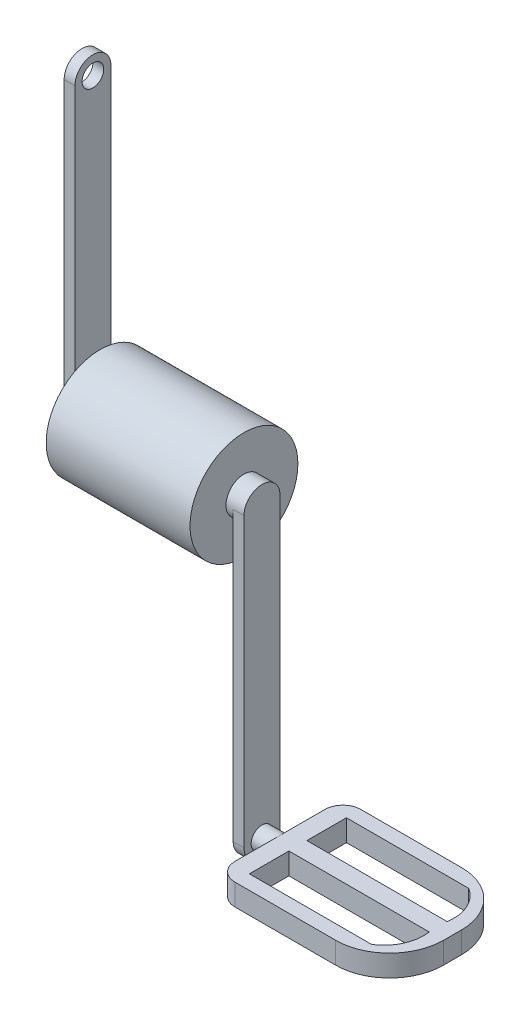
from build123d import *

# Parameters (mm, degrees)
SKETCH1_R           = 15
BOSS_EXTRUDE1_DEPTH = 20
SKETCH2_R           = 5
BOSS_EXTRUDE2_DEPTH = 25
SKETCH3_R           = 3
BOSS_EXTRUDE3_DEPTH = 3
SKETCH4_R           = 3
BOSS_EXTRUDE4_DEPTH = 3
SKETCH5_R           = 3
BOSS_EXTRUDE5_DEPTH = 8
SKETCH6_W           = 35
SKETCH6_H           = 6
BOSS_EXTRUDE6_DEPTH = 48
FILLET1_R           = 15
FILLET2_R           = 5
CUT_EXTRUDE1_DEPTH  = 48


with BuildPart() as part:
    # Sketch1 → Boss-Extrude1 (new, symmetric)
    with BuildSketch(Plane(origin=(0, 0, 0), x_dir=(0, 0, -1), z_dir=(1, 0, 0))):
        Circle(SKETCH1_R)
    extrude(amount=BOSS_EXTRUDE1_DEPTH, both=True)

    # Sketch2 → Boss-Extrude2 (add, symmetric)
    with BuildSketch(Plane(origin=(0, 0, 0), x_dir=(0, 0, -1), z_dir=(1, 0, 0))):
        with Locations(Location((0, 0, 0), (0, 0, 180))):
            Circle(SKETCH2_R)
    extrude(amount=BOSS_EXTRUDE2_DEPTH, both=True)

    # Sketch3 → Boss-Extrude3 (add)
    with BuildSketch(Plane(origin=(25, 0, 0), x_dir=(0, 0, -1), z_dir=(1, 0, 0))):
        with BuildLine():
            Line((-5, 0), (5, 0))
            Line((5, 0), (5, -80))
            ThreePointArc((5, -80), (0, -85), (-5, -80))
            Line((-5, -80), (-5, 0))
        make_face()
        with Locations((0, -80)):
            Circle(SKETCH3_R, mode=Mode.SUBTRACT)
    extrude(amount=-BOSS_EXTRUDE3_DEPTH)

    # Sketch4 → Boss-Extrude4 (add)
    with BuildSketch(Plane.ZY.offset(25)):
        with BuildLine():
            Line((-5, 0), (5, 0))
            Line((5, 0), (5, 80))
            ThreePointArc((5, 80), (-3.35e-07, 85), (-5, 79.99999933))
            Line((-5, 79.99999933), (-5, 0))
        make_face()
        with Locations((0, 80)):
            Circle(SKETCH4_R, mode=Mode.SUBTRACT)
    extrude(amount=-BOSS_EXTRUDE4_DEPTH)


with BuildPart() as body_2:
    # Sketch5 → Boss-Extrude5 (new body)
    with BuildSketch(Plane.ZY.offset(-22)):
        with Locations((0, -80)):
            Circle(SKETCH5_R)
    extrude(amount=-BOSS_EXTRUDE5_DEPTH)

    # Sketch6 → Boss-Extrude6 (add)
    with BuildSketch(Plane(origin=(30, 0, 0), x_dir=(0, 0, -1), z_dir=(1, 0, 0))):
        with Locations((0, -80)):
            Rectangle(SKETCH6_W, SKETCH6_H)
    extrude(amount=BOSS_EXTRUDE6_DEPTH)

    # Fillet1
    fillet1_edges = [body_2.edges().sort_by_distance(p)[0] for p in [
        (78, -80, 17.5),
        (78, -80, -17.5),
    ]]
    fillet(fillet1_edges, radius=FILLET1_R)

    # Fillet2
    fillet2_edges = [body_2.edges().sort_by_distance(p)[0] for p in [
        (30, -80, 17.5),
        (30, -80, -17.5),
    ]]
    fillet(fillet2_edges, radius=FILLET2_R)

    # Sketch7 → Cut-Extrude1 (cut)
    with BuildSketch(Plane(origin=(0, -77, 0), x_dir=(1, 0, 0), z_dir=(0, 1, 0))):
        with BuildLine():
            Line((74, 2.5), (35, 2.5))
            Line((35, 2.5), (35, 13.5))
            Line((35, 13.5), (69, 13.5))
            ThreePointArc((69, 13.5), (73.145589228, 8.747995103), (74, 2.5))
        make_face()
        with BuildLine():
            Line((74, -2.5), (35, -2.5))
            Line((35, -2.5), (35, -13.5))
            Line((35, -13.5), (69, -13.5))
            ThreePointArc((69, -13.5), (73.145589228, -8.747995103), (74, -2.5))
        make_face()
    extrude(amount=-CUT_EXTRUDE1_DEPTH, mode=Mode.SUBTRACT)


solid = Compound([part.part, body_2.part])
